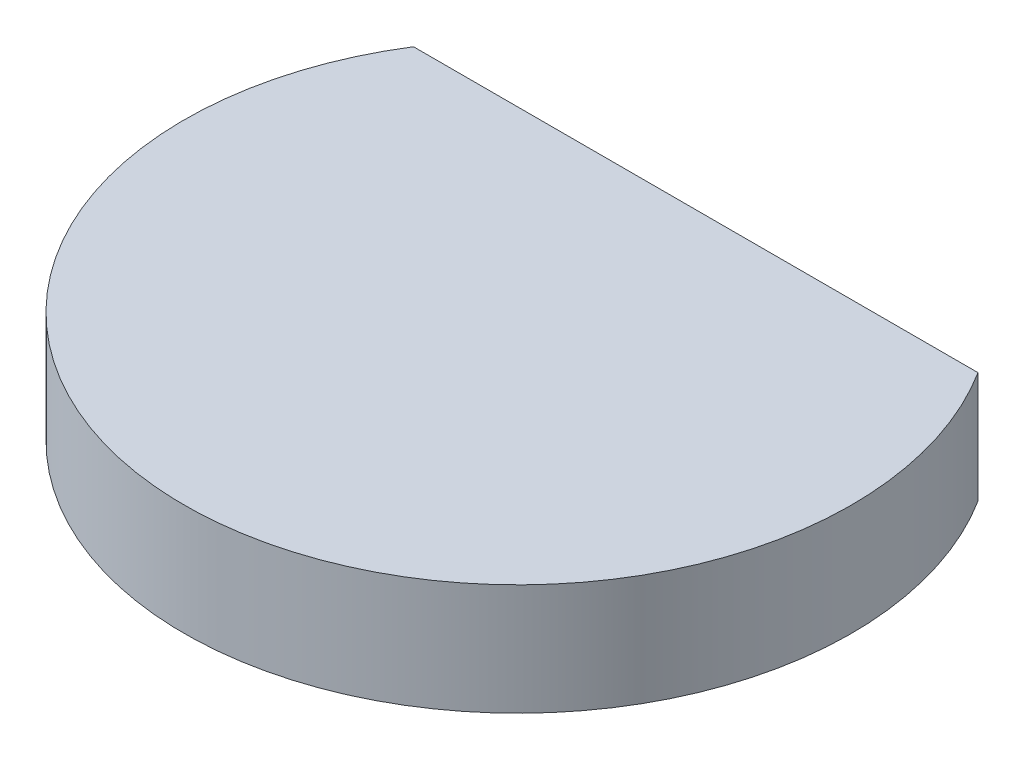
from build123d import *

# Parameters (mm, degrees)
BOSS_EXTRUDE1_DEPTH = 0.1


with BuildPart() as part:
    # Sketch1 → Boss-Extrude1 (new body)
    with BuildSketch(Plane(origin=(0, 0, 0), x_dir=(1, 0, 0), z_dir=(0, 1, 0))):
        with BuildLine():
            Line((-0.253771551, 0.16), (0.253771551, 0.16))
            ThreePointArc((0.253771551, 0.16), (0, -0.3), (-0.253771551, 0.16))
        make_face()
    extrude(amount=BOSS_EXTRUDE1_DEPTH)


solid = part.part
